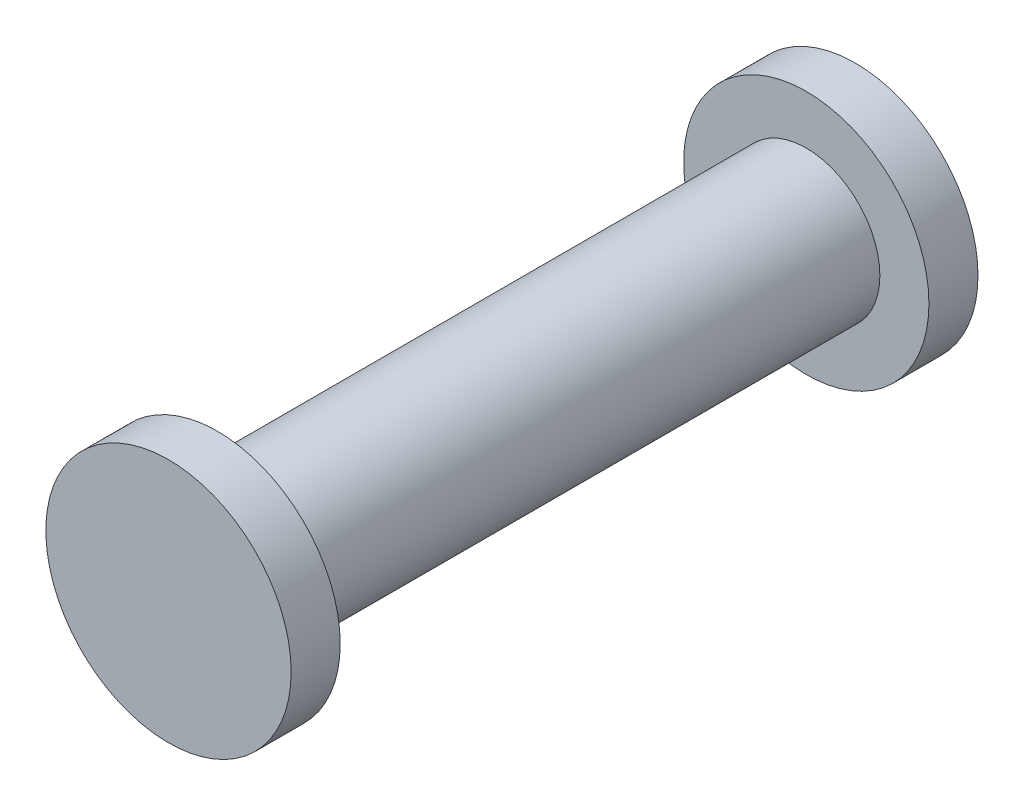
from build123d import *

# Parameters (mm, degrees)
SKETCH1_R           = 2.5
BOSS_EXTRUDE1_DEPTH = 1
SKETCH2_R           = 1.5
BOSS_EXTRUDE2_DEPTH = 12
SKETCH3_R           = 2.5
BOSS_EXTRUDE3_DEPTH = 1


with BuildPart() as part:
    # Sketch1 → Boss-Extrude1 (new body)
    with BuildSketch(Plane.XY):
        Circle(SKETCH1_R)
    extrude(amount=BOSS_EXTRUDE1_DEPTH)

    # Sketch2 → Boss-Extrude2 (add)
    with BuildSketch(Plane.XY.offset(1)):
        Circle(SKETCH2_R)
    extrude(amount=BOSS_EXTRUDE2_DEPTH)

    # Sketch3 → Boss-Extrude3 (add)
    with BuildSketch(Plane.XY.offset(13)):
        Circle(SKETCH3_R)
    extrude(amount=BOSS_EXTRUDE3_DEPTH)


solid = part.part
